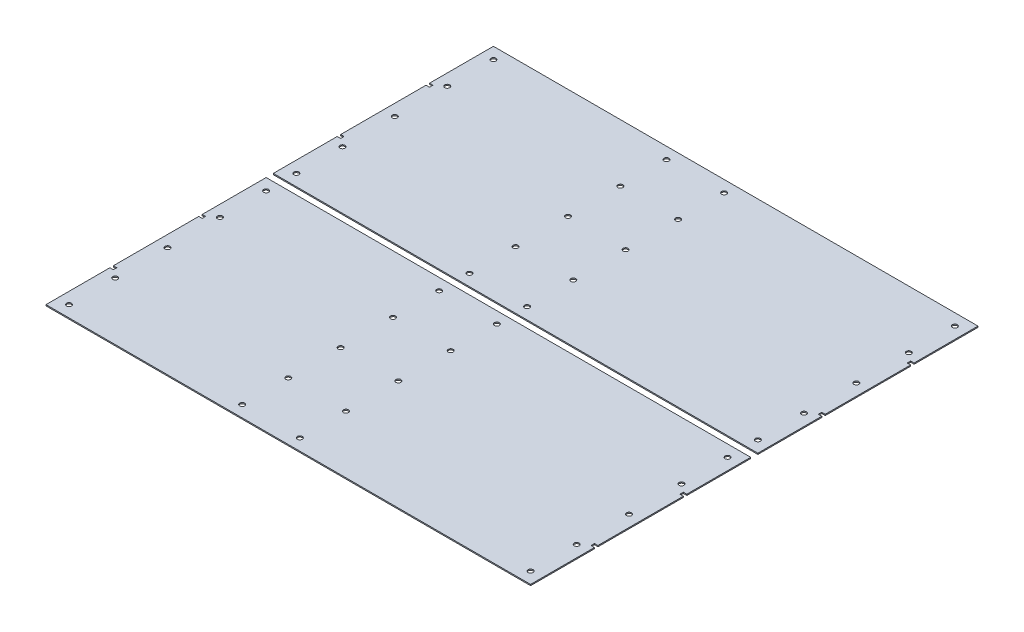
from build123d import *

# Parameters (mm, degrees)
SKETCH1_R           = 2.15
BOSS_EXTRUDE1_DEPTH = 1
LPATTERN2_COUNT     = 2
LPATTERN2_PITCH     = 197


with BuildPart() as part:
    # Sketch1 → Boss-Extrude1 (new body)
    with BuildSketch(Plane(origin=(0, 0, 0), x_dir=(1, 0, 0), z_dir=(0, 1, 0))):
        Polygon((-10, -40), (-10, -95.4), (410, -95.4), (410, -40), (407, -40), (407, -37), (410, -37), (410, 37), (407, 37), (407, 40), (410, 40), (410, 95.4), (-10, 95.4), (-10, 40), (-7, 40), (-7, 37), (-10, 37), (-10, -37), (-7, -37), (-7, -40), align=None)
        with Locations(Location((0, -45.4, 0), (0, 0, 270))):
            Circle(SKETCH1_R, mode=Mode.SUBTRACT)
        with Locations(Location((0, 45.4, 0), (0, 0, 270))):
            Circle(SKETCH1_R, mode=Mode.SUBTRACT)
        with Locations(Location((0, -85.4, 0), (0, 0, 270))):
            Circle(SKETCH1_R, mode=Mode.SUBTRACT)
        with Locations(Location((0, 85.4, 0), (0, 0, 270))):
            Circle(SKETCH1_R, mode=Mode.SUBTRACT)
        with Locations(Location((200, -85.4, 0), (0, 0, 270))):
            Circle(SKETCH1_R, mode=Mode.SUBTRACT)
        with Locations(Location((200, -45.4, 0), (0, 0, 270))):
            Circle(SKETCH1_R, mode=Mode.SUBTRACT)
        with Locations(Location((200, 45.4, 0), (0, 0, 270))):
            Circle(SKETCH1_R, mode=Mode.SUBTRACT)
        with Locations(Location((200, 85.4, 0), (0, 0, 270))):
            Circle(SKETCH1_R, mode=Mode.SUBTRACT)
        with Locations(Location((0, 0, 0), (0, 0, 270))):
            Circle(SKETCH1_R, mode=Mode.SUBTRACT)
        with Locations(Location((400, 0, 0), (0, 0, 270))):
            Circle(SKETCH1_R, mode=Mode.SUBTRACT)
        with Locations(Location((200, 0, 0), (0, 0, 270))):
            Circle(SKETCH1_R, mode=Mode.SUBTRACT)
        with Locations(Location((400, 85.4, 0), (0, 0, 270))):
            Circle(SKETCH1_R, mode=Mode.SUBTRACT)
        with Locations(Location((400, 45.4, 0), (0, 0, 270))):
            Circle(SKETCH1_R, mode=Mode.SUBTRACT)
        with Locations(Location((400, -45.4, 0), (0, 0, 270))):
            Circle(SKETCH1_R, mode=Mode.SUBTRACT)
        with Locations(Location((400, -85.4, 0), (0, 0, 270))):
            Circle(SKETCH1_R, mode=Mode.SUBTRACT)
        with Locations(Location((150, 85.4, 0), (0, 0, 270))):
            Circle(SKETCH1_R, mode=Mode.SUBTRACT)
        with Locations(Location((150, 45.4, 0), (0, 0, 270))):
            Circle(SKETCH1_R, mode=Mode.SUBTRACT)
        with Locations(Location((150, -85.4, 0), (0, 0, 270))):
            Circle(SKETCH1_R, mode=Mode.SUBTRACT)
        with Locations(Location((150, -45.4, 0), (0, 0, 270))):
            Circle(SKETCH1_R, mode=Mode.SUBTRACT)
        with Locations(Location((150, 0, 0), (0, 0, 270))):
            Circle(SKETCH1_R, mode=Mode.SUBTRACT)
    extrude(amount=BOSS_EXTRUDE1_DEPTH)


with BuildPart() as lpattern2_1:
    # LPattern2: pattern copy
    add(part.part.moved(Location(Vector(0, 0, -1) * (1 * LPATTERN2_PITCH))))


solid = Compound([part.part, lpattern2_1.part])
